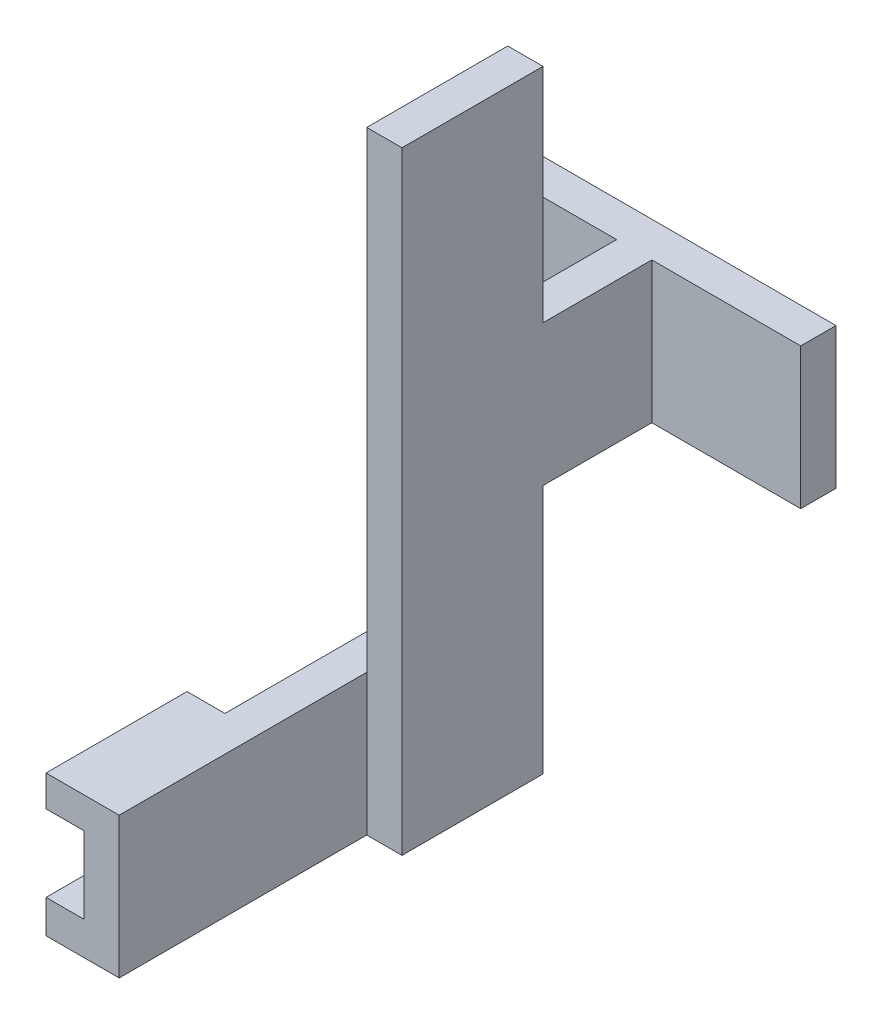
from build123d import *

# Parameters (mm, degrees)
CROQUIS1_W              = 120
CROQUIS1_H              = 50.8
SALIENTE_EXTRUIR1_DEPTH = 12.7
CROQUIS2_W              = 12.7
CROQUIS2_H              = 50.8
SALIENTE_EXTRUIR2_DEPTH = 90
CROQUIS3_W              = 12.7
CROQUIS3_H              = 50.8
SALIENTE_EXTRUIR3_DEPTH = 90
CROQUIS4_W              = 140
CROQUIS4_H              = 50.8
SALIENTE_EXTRUIR4_DEPTH = 12.7
CROQUIS5_W              = 50.8
CROQUIS5_H              = 11.980562802
CROQUIS5_H_2            = 11.193759738
SALIENTE_EXTRUIR5_DEPTH = 13.65
CROQUIS6_W              = 12.7
CROQUIS6_H              = 50.8
SALIENTE_EXTRUIR6_DEPTH = 80


with BuildPart() as part:
    # Croquis1 → Saliente-Extruir1 (new body)
    with BuildSketch(Plane.XY):
        Rectangle(CROQUIS1_W, CROQUIS1_H)
    extrude(amount=SALIENTE_EXTRUIR1_DEPTH)

    # Croquis2 → Saliente-Extruir2 (add)
    with BuildSketch(Plane.XY.offset(12.7)):
        Rectangle(CROQUIS2_W, CROQUIS2_H)
    extrude(amount=SALIENTE_EXTRUIR2_DEPTH)

    # Croquis3 → Saliente-Extruir3 (add)
    with BuildSketch(Plane.XZ.offset(25.4)):
        with Locations((0, 77.3)):
            Rectangle(CROQUIS3_W, CROQUIS3_H)
    extrude(amount=SALIENTE_EXTRUIR3_DEPTH)

    # Croquis4 → Saliente-Extruir4 (add)
    with BuildSketch(Plane.ZY.offset(6.35)):
        with Locations((121.9, -90)):
            Rectangle(CROQUIS4_W, CROQUIS4_H)
    extrude(amount=SALIENTE_EXTRUIR4_DEPTH)

    # Croquis5 → Saliente-Extruir5 (add)
    with BuildSketch(Plane.ZY.offset(19.05)):
        with Locations((166.5, -109.409718599)):
            Rectangle(CROQUIS5_W, CROQUIS5_H)
        with Locations((166.5, -70.196879869)):
            Rectangle(CROQUIS5_W, CROQUIS5_H_2)
    extrude(amount=SALIENTE_EXTRUIR5_DEPTH)

    # Croquis6 → Saliente-Extruir6 (add)
    with BuildSketch(Plane(origin=(0, 25.4, 0), x_dir=(1, 0, 0), z_dir=(0, 1, 0))):
        with Locations((0, -77.3)):
            Rectangle(CROQUIS6_W, CROQUIS6_H)
    extrude(amount=SALIENTE_EXTRUIR6_DEPTH)


solid = part.part
